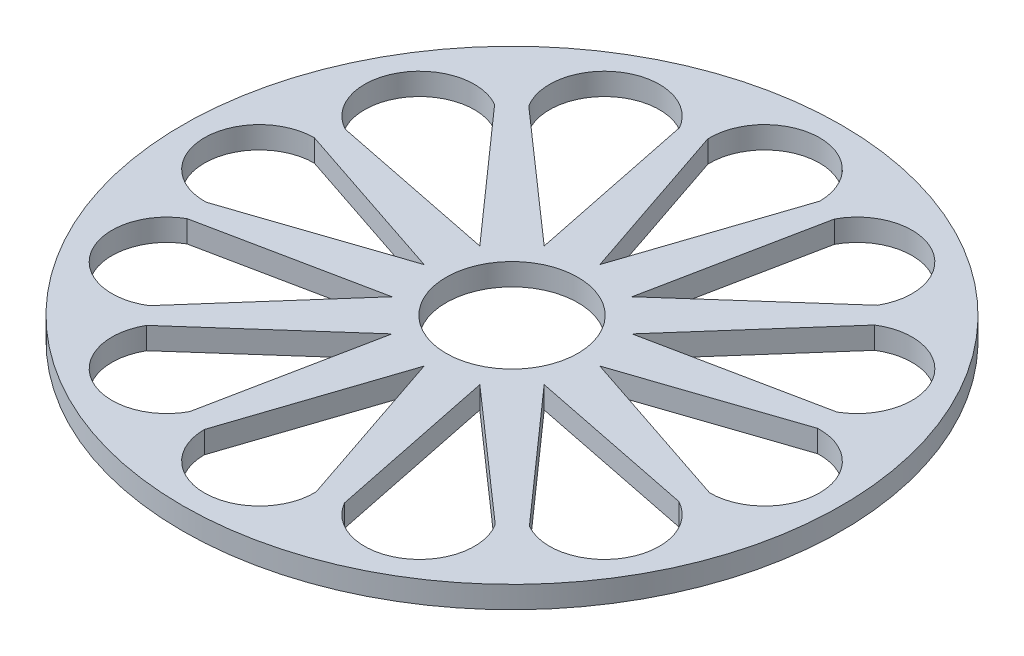
from build123d import *

# Parameters (mm, degrees)
SKETCH1_R         = 30
SKETCH1_R_2       = 6
EXTRUDE1_DEPTH    = 2
EXTRUDE2_DEPTH    = 2
CIRPATTERN1_COUNT = 12


with BuildPart() as part:
    # Sketch1 → Extrude1 (new body)
    with BuildSketch(Plane(origin=(0, 0, 0), x_dir=(1, 0, 0), z_dir=(0, 1, 0))):
        with Locations(Location((0, 0, 0), (0, 0, 270))):
            Circle(SKETCH1_R)
        with Locations(Location((0, 0, 0), (0, 0, 270))):
            Circle(SKETCH1_R_2, mode=Mode.SUBTRACT)
    extrude(amount=EXTRUDE1_DEPTH)

    # Sketch2 → Extrude2 (cut)
    with BuildSketch(Plane(origin=(0, 2, 0), x_dir=(1, 0, 0), z_dir=(0, 1, 0))):
        with BuildLine():
            Line((-5, 22.825230384), (0, 8))
            Line((0, 8), (5.003053509, 23))
            ThreePointArc((5.003053509, 23), (-0.087398144, 28.002290074), (-5, 22.825230384))
        make_face()
    extrude2 = extrude(amount=-EXTRUDE2_DEPTH, mode=Mode.SUBTRACT)

    # CirPattern1: Extrude2 ×12 about axis
    cirpattern1_axis = Axis((0, 0, 0), (0, 1, 0))
    for i in range(1, CIRPATTERN1_COUNT):
        add(extrude2.rotate(cirpattern1_axis, i * 360 / CIRPATTERN1_COUNT), mode=Mode.SUBTRACT)


solid = part.part
